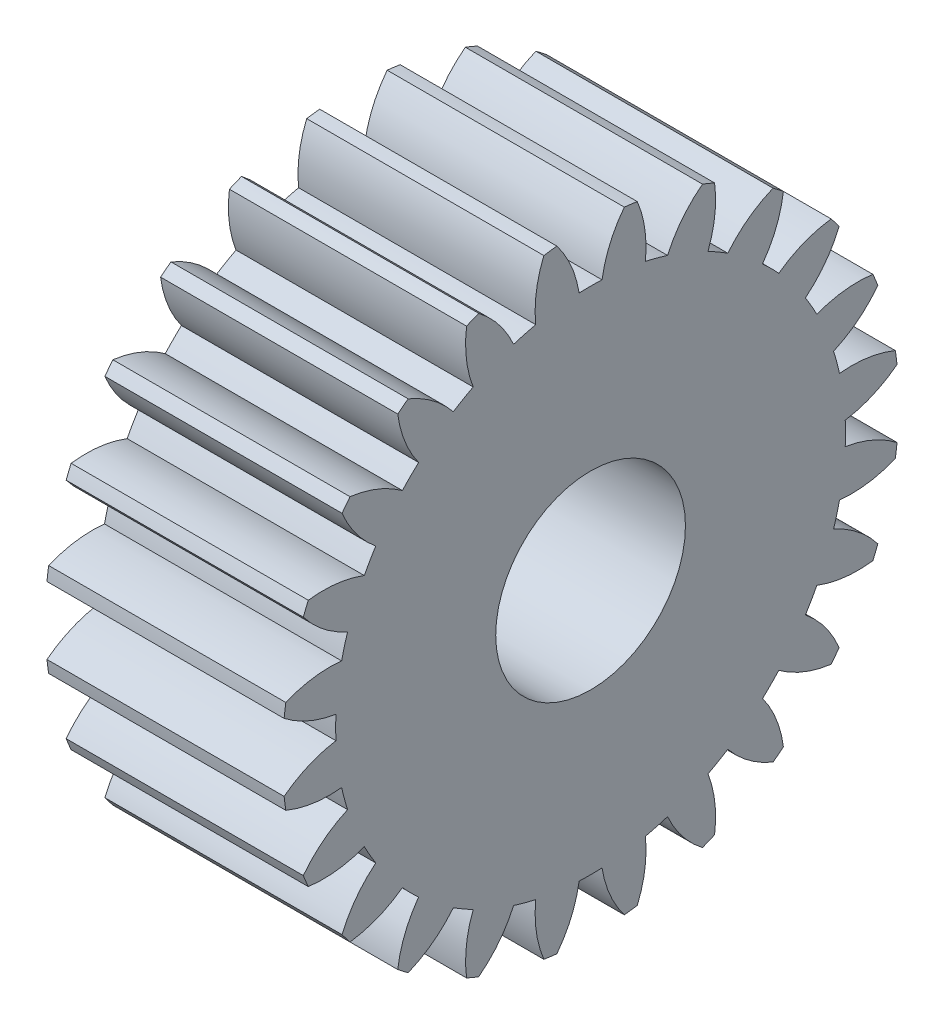
from build123d import *

# Parameters (mm, degrees)
BASPROSKE_W     = 5
BASPROSKE_H     = 6.5
TOOTHCUT_DEPTH  = 11.464224768
TEETHCUTS_COUNT = 24
TEETHCUTS_ANGLE = 345
BORSKE_R        = 2
BORE_DEPTH      = 50.0000508


with BuildPart() as part:
    # BasProSke → Base-Revolve (revolve)
    with BuildSketch(Plane(origin=(0, 0, 0), x_dir=(1, 0, 0), z_dir=(0, 1, 0)), mode=Mode.PRIVATE) as base_revolve_sk:
        with Locations((2.5, 3.25)):
            Rectangle(BASPROSKE_W, BASPROSKE_H)
    revolve(base_revolve_sk.sketch.rotate(Axis((-10, 0, 0), (1, 0, 0)), 180), axis=Axis((-10, 0, 0), (1, 0, 0)))

    # TooCutSke → ToothCut (cut, through all)
    with BuildSketch(Plane(origin=(0, 0, 0), x_dir=(0, 0, -1), z_dir=(1, 0, 0))):
        with BuildLine():
            ThreePointArc((0.241646108, 5.368564348), (0, 5.374), (-0.241646108, 5.368564348))
            ThreePointArc((-0.241646108, 5.368564348), (-0.413699957, 5.957993365), (-0.729686037, 6.48447403))
            ThreePointArc((-0.729686037, 6.48447403), (0, 6.5254), (0.729686037, 6.48447403))
            ThreePointArc((0.729686037, 6.48447403), (0.413699957, 5.957993365), (0.241646108, 5.368564348))
        make_face()
    toothcut = extrude(amount=TOOTHCUT_DEPTH, mode=Mode.SUBTRACT)

    # TeethCuts: ToothCut ×24 about axis
    teethcuts_axis = Axis((-10, 0, 0), (1, 0, 0))
    for i in range(1, TEETHCUTS_COUNT):
        add(toothcut.rotate(teethcuts_axis, i * TEETHCUTS_ANGLE / (TEETHCUTS_COUNT - 1)), mode=Mode.SUBTRACT)

    # BorSke → Bore (cut, symmetric)
    with BuildSketch(Plane(origin=(0, 0, 0), x_dir=(0, 0, -1), z_dir=(1, 0, 0))):
        with Locations(Location((0, 0, 0), (0, 0, 180))):
            Circle(BORSKE_R)
    extrude(amount=BORE_DEPTH, both=True, mode=Mode.SUBTRACT)


solid = part.part
